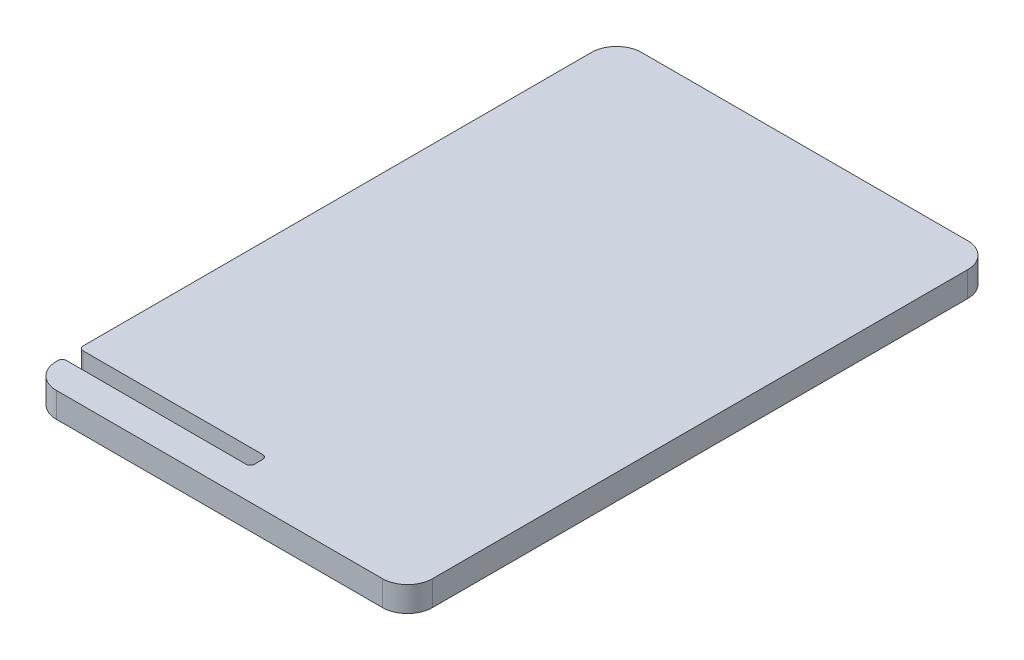
from build123d import *

# Parameters (mm, degrees)
CROQUIS1_W              = 45
CROQUIS1_H              = 70
SALIENTE_EXTRUIR1_DEPTH = 3
CROQUIS2_W              = 22.5
CROQUIS2_H              = 2
CORTAR_EXTRUIR1_DEPTH   = 3
REDONDEO1_R             = 3
REDONDEO2_R             = 0.5


with BuildPart() as part:
    # Croquis1 → Saliente-Extruir1 (new body)
    with BuildSketch(Plane(origin=(0, 0, 0), x_dir=(1, 0, 0), z_dir=(0, 1, 0))):
        with Locations((0, 0.306231574)):
            Rectangle(CROQUIS1_W, CROQUIS1_H)
    extrude(amount=SALIENTE_EXTRUIR1_DEPTH)

    # Croquis2 → Cortar-Extruir1 (cut)
    with BuildSketch(Plane(origin=(0, 3, 0), x_dir=(1, 0, 0), z_dir=(0, 1, 0))):
        with Locations((-11.25, -30)):
            Rectangle(CROQUIS2_W, CROQUIS2_H)
    extrude(amount=-CORTAR_EXTRUIR1_DEPTH, mode=Mode.SUBTRACT)

    # Redondeo1
    redondeo1_edges = [part.edges().sort_by_distance(p)[0] for p in [
        (-22.5, 1.5, -35.306231574),
        (22.5, 1.5, -35.306231574),
        (22.5, 1.5, 34.693768426),
        (-22.5, 1.5, 34.693768426),
    ]]
    fillet(redondeo1_edges, radius=REDONDEO1_R)

    # Redondeo2
    redondeo2_edges = [part.edges().sort_by_distance(p)[0] for p in [
        (-22.5, 1.5, 31),
        (-22.5, 1.5, 29),
        (0, 1.5, 29),
        (0, 1.5, 31),
    ]]
    fillet(redondeo2_edges, radius=REDONDEO2_R)


solid = part.part
